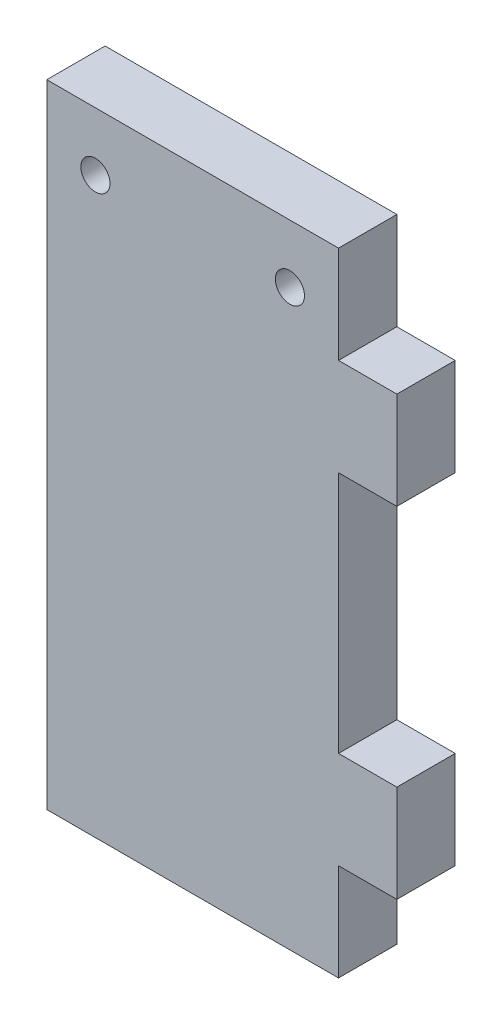
from build123d import *

# Parameters (mm, degrees)
ESQUISSE1_W             = 30
ESQUISSE1_H             = 65
BOSS_EXTRU_1_DEPTH      = 6
ESQUISSE2_W             = 6
ESQUISSE2_H             = 10
BOSS_EXTRU_3_DEPTH      = 6
ESQUISSE3_R             = 1.5
ENL_V_MAT_EXTRU_1_DEPTH = 6


with BuildPart() as part:
    # Esquisse1 → Boss.-Extru.1 (new body)
    with BuildSketch(Plane.XY):
        with Locations((-15, 32.5)):
            Rectangle(ESQUISSE1_W, ESQUISSE1_H)
    extrude(amount=BOSS_EXTRU_1_DEPTH)

    # Esquisse2 → Boss.-Extru.3 (add)
    with BuildSketch(Plane(origin=(0, 0, 0), x_dir=(0, 0, -1), z_dir=(1, 0, 0))):
        with Locations((-3, 15)):
            Rectangle(ESQUISSE2_W, ESQUISSE2_H)
        with Locations((-3, 50)):
            Rectangle(ESQUISSE2_W, ESQUISSE2_H)
    extrude(amount=BOSS_EXTRU_3_DEPTH)

    # Esquisse3 → Enlèv. mat.-Extru.1 (cut)
    with BuildSketch(Plane.XY.offset(6)):
        with Locations((-25, 59)):
            Circle(ESQUISSE3_R)
        with Locations((-5, 59)):
            Circle(ESQUISSE3_R)
    extrude(amount=-ENL_V_MAT_EXTRU_1_DEPTH, mode=Mode.SUBTRACT)


solid = part.part
